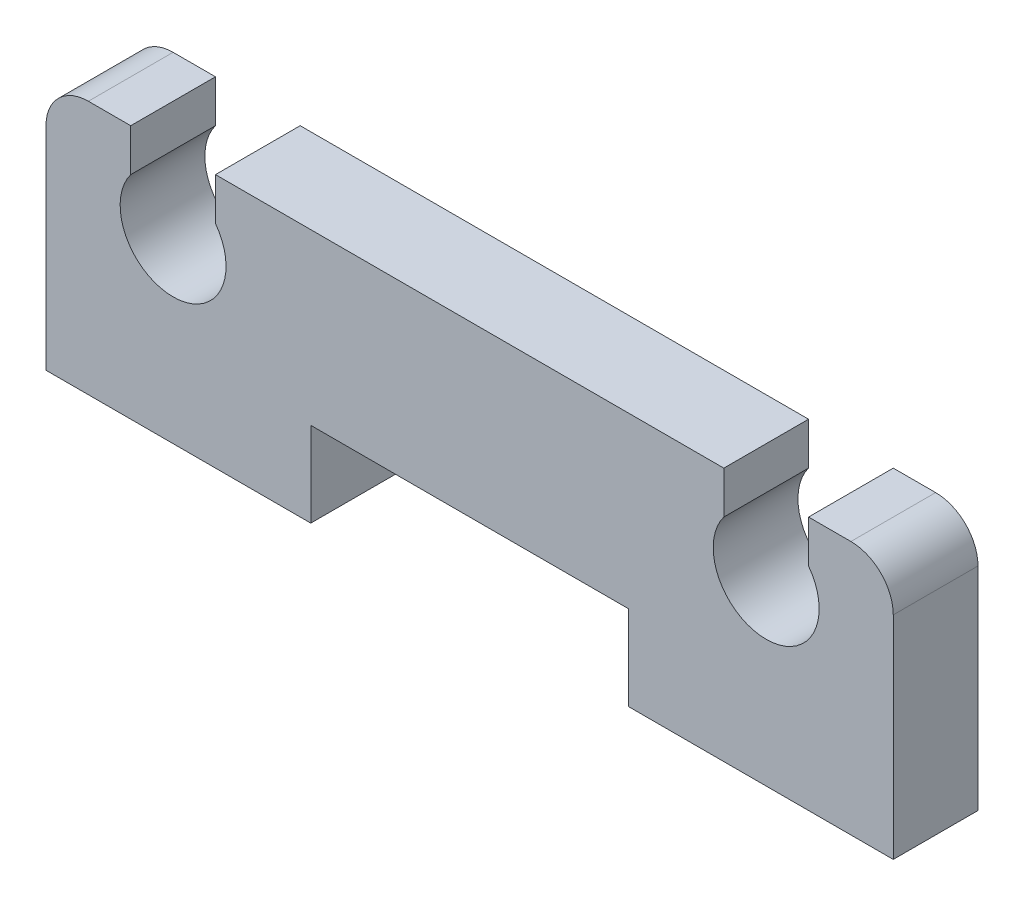
from build123d import *

# Parameters (mm, degrees)
BOSS_EXTRUDE1_DEPTH = 2


with BuildPart() as part:
    # Model → Boss-Extrude1 (new body)
    with BuildSketch(Plane.XY):
        with BuildLine():
            Line((1971.359841287, 1290.960216851), (1978.859841287, 1290.960216851))
            Line((1978.859841287, 1290.960216851), (1978.859841287, 1288.960216851))
            Line((1978.859841287, 1288.960216851), (1985.109841287, 1288.960216851))
            Line((1985.109841287, 1288.960216851), (1985.109841287, 1293.960216851))
            ThreePointArc((1985.109841287, 1293.960216851), (1984.816948068, 1294.667323632), (1984.109841287, 1294.960216851))
            Line((1984.109841287, 1294.960216851), (1983.109841287, 1294.960216851))
            Line((1983.109841287, 1294.960216851), (1983.109841287, 1293.960216851))
            ThreePointArc((1983.109841287, 1293.960216851), (1982.109841287, 1291.960216851), (1981.109841287, 1293.960216851))
            Line((1981.109841287, 1293.960216851), (1981.109841287, 1294.960216851))
            Line((1981.109841287, 1294.960216851), (1969.109841287, 1294.960216851))
            Line((1969.109841287, 1294.960216851), (1969.109841287, 1293.960216851))
            ThreePointArc((1969.109841287, 1293.960216851), (1968.109841287, 1291.960216851), (1967.109841287, 1293.960216851))
            Line((1967.109841287, 1293.960216851), (1967.109841287, 1294.960216851))
            Line((1967.109841287, 1294.960216851), (1966.109841287, 1294.960216851))
            ThreePointArc((1966.109841287, 1294.960216851), (1965.402734505, 1294.667323632), (1965.109841287, 1293.960216851))
            Line((1965.109841287, 1293.960216851), (1965.109841287, 1288.960216851))
            Line((1965.109841287, 1288.960216851), (1971.359841287, 1288.960216851))
            Line((1971.359841287, 1288.960216851), (1971.359841287, 1290.960216851))
        make_face()
    extrude(amount=BOSS_EXTRUDE1_DEPTH)


solid = part.part
